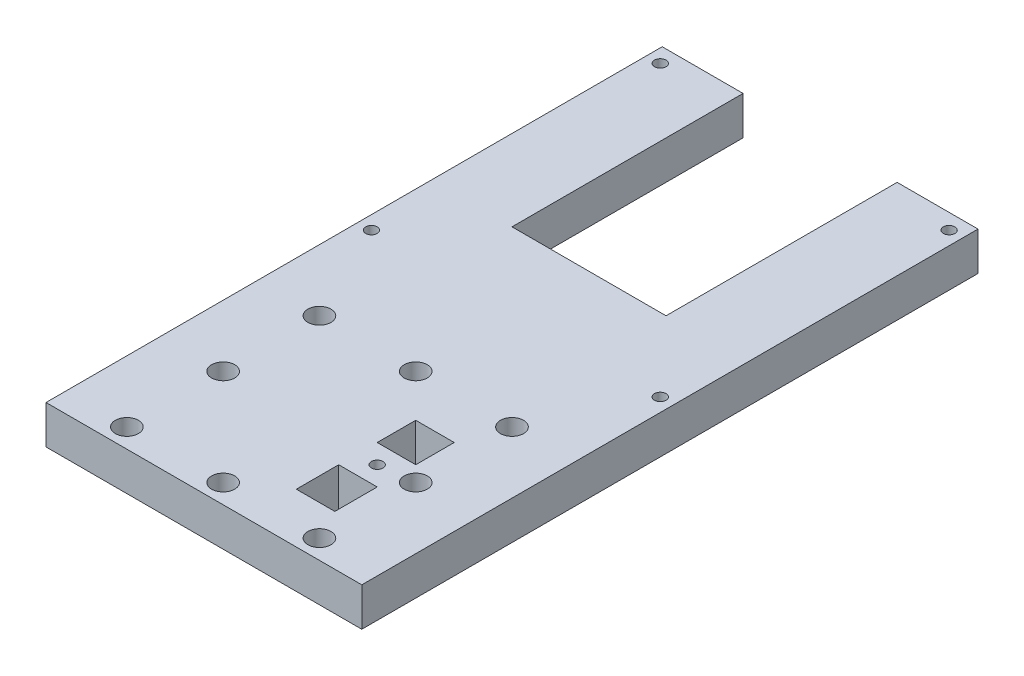
from build123d import *

# Parameters (mm, degrees)
SKETCH1_R           = 3
SKETCH1_R_2         = 1.5
SKETCH1_W           = 10
SKETCH1_H           = 11
SKETCH1_H_2         = 10
BOSS_EXTRUDE1_DEPTH = 10


with BuildPart() as part:
    # Sketch1 → Boss-Extrude1 (new body)
    with BuildSketch(Plane(origin=(0, 0, 0), x_dir=(1, 0, 0), z_dir=(0, 1, 0))):
        Polygon((32.969203123, -64.744115369), (-49.030796877, -64.744115369), (-49.030796877, 95.255884631), (-28.030796877, 95.255884631), (-28.030796877, 35.255884631), (11.969203123, 35.255884631), (11.969203123, 95.255884631), (32.969203123, 95.255884631), align=None)
        with Locations(Location((-33.030796877, -59.744115369, 0), (0, 0, 270))):
            Circle(SKETCH1_R, mode=Mode.SUBTRACT)
        with Locations(Location((16.969203123, -59.744115369, 0), (0, 0, 270))):
            Circle(SKETCH1_R, mode=Mode.SUBTRACT)
        with Locations(Location((16.969203123, -9.744115369, 0), (0, 0, 270))):
            Circle(SKETCH1_R, mode=Mode.SUBTRACT)
        with Locations(Location((-33.030796877, -9.744115369, 0), (0, 0, 270))):
            Circle(SKETCH1_R, mode=Mode.SUBTRACT)
        with Locations(Location((-45.530796877, 91.255884631, 0), (0, 0, 270))):
            Circle(SKETCH1_R_2, mode=Mode.SUBTRACT)
        with Locations(Location((29.469203123, 91.255884631, 0), (0, 0, 270))):
            Circle(SKETCH1_R_2, mode=Mode.SUBTRACT)
        with Locations(Location((29.469203123, 16.255884631, 0), (0, 0, 270))):
            Circle(SKETCH1_R_2, mode=Mode.SUBTRACT)
        with Locations(Location((-45.530796877, 16.255884631, 0), (0, 0, 270))):
            Circle(SKETCH1_R_2, mode=Mode.SUBTRACT)
        with Locations(Location((-8.030796877, -9.744115369, 0), (0, 0, 270))):
            Circle(SKETCH1_R, mode=Mode.SUBTRACT)
        with Locations(Location((-33.030796877, -34.744115369, 0), (0, 0, 270))):
            Circle(SKETCH1_R, mode=Mode.SUBTRACT)
        with Locations(Location((16.969203123, -34.744115369, 0), (0, 0, 270))):
            Circle(SKETCH1_R, mode=Mode.SUBTRACT)
        with Locations(Location((-8.030796877, -59.744115369, 0), (0, 0, 270))):
            Circle(SKETCH1_R, mode=Mode.SUBTRACT)
        with Locations(Location((7.969203123, -35.744115369, 0), (0, 0, 270))):
            Circle(SKETCH1_R_2, mode=Mode.SUBTRACT)
        with Locations((7.969203123, -46.244115369)):
            Rectangle(SKETCH1_W, SKETCH1_H, mode=Mode.SUBTRACT)
        with Locations((7.969203123, -25.744115369)):
            Rectangle(SKETCH1_W, SKETCH1_H_2, mode=Mode.SUBTRACT)
    extrude(amount=BOSS_EXTRUDE1_DEPTH)


solid = part.part
